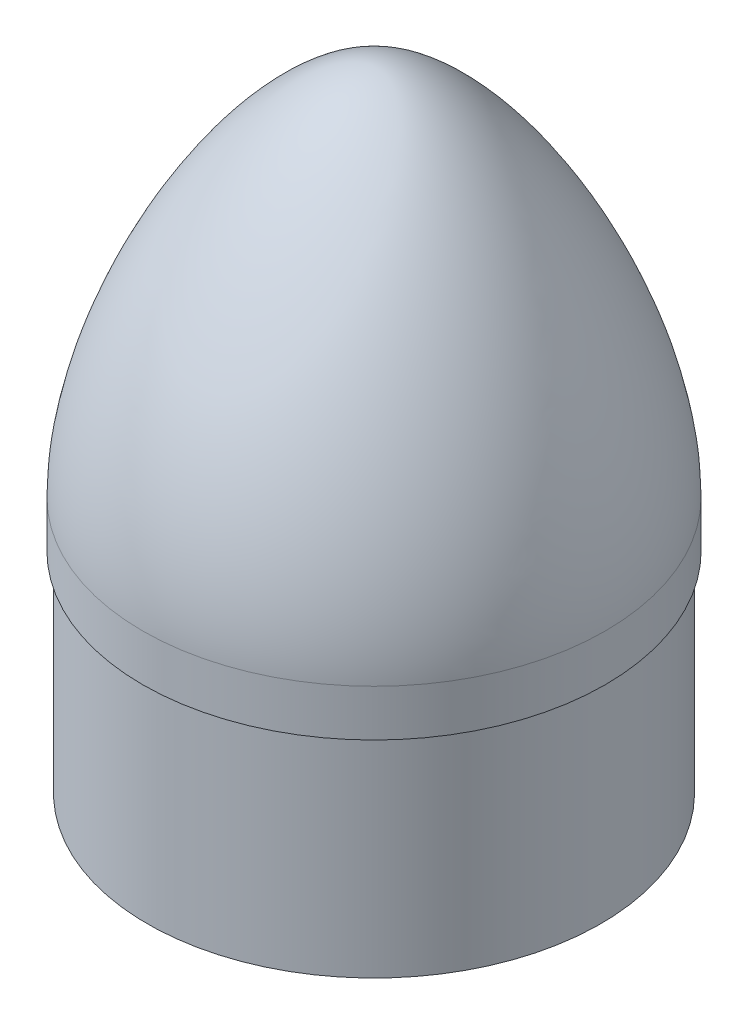
from build123d import *


with BuildPart() as part:
    # Sketch1 → Revolve1 (revolve)
    with BuildSketch(Plane.XY, mode=Mode.PRIVATE) as revolve1_sk:
        with BuildLine():
            Line((-24.35, 0), (-24.35, 22.5))
            Line((-24.35, 22.5), (-24.85, 22.5))
            Line((-24.85, 22.5), (-24.85, 27.5))
            add(Edge.make_bspline(
                [(-24.85, 27.5), (-24.85, 43.780206444), (-10.204077545, 67.5), (0, 67.5)],
                knots=[0, 0, 0, 0, 1, 1, 1, 1], degree=3))
            Line((0, 67.5), (0, 67))
            add(Edge.make_bspline(
                [(-24.347860096, 27.839321298), (-24.341499711, 28.346010553), (-24.301638833, 29.348577965), (-24.11580728, 31.431845462), (-23.693138479, 34.108229535), (-22.907065114, 37.40744686), (-21.522873709, 41.854689286), (-19.230151883, 47.392139738), (-15.79882975, 53.635971479), (-11.911009312, 59.115064281), (-8.481216154, 62.739755317), (-5.747015733, 64.892995549), (-3.734640767, 66.090760209), (-2.124093421, 66.707799141), (-0.885893826, 66.957799804), (-0.298692976, 67), (0, 67)],
                knots=[0.007053509, 0.007053509, 0.007053509, 0.007053509, 0.038083087, 0.069112665, 0.13117182, 0.193230976, 0.255290132, 0.379408443, 0.503526755, 0.627645066, 0.751763377, 0.813822533, 0.875881689, 0.937940844, 0.968970422, 1, 1, 1, 1], degree=3))
            Line((-24.347860096, 27.839321298), (-24.35, 27.339325877))
            Line((-24.35, 27.339325877), (-24.35, 23))
            Line((-24.35, 23), (-23.85, 23))
            Line((-23.85, 23), (-23.85, 0))
            Line((-23.85, 0), (-24.35, 0))
        make_face()
    revolve(revolve1_sk.sketch.rotate(Axis((0, 0, 0), (0, 1, 0)), 270), axis=Axis((0, 0, 0), (0, 1, 0)))


solid = part.part
